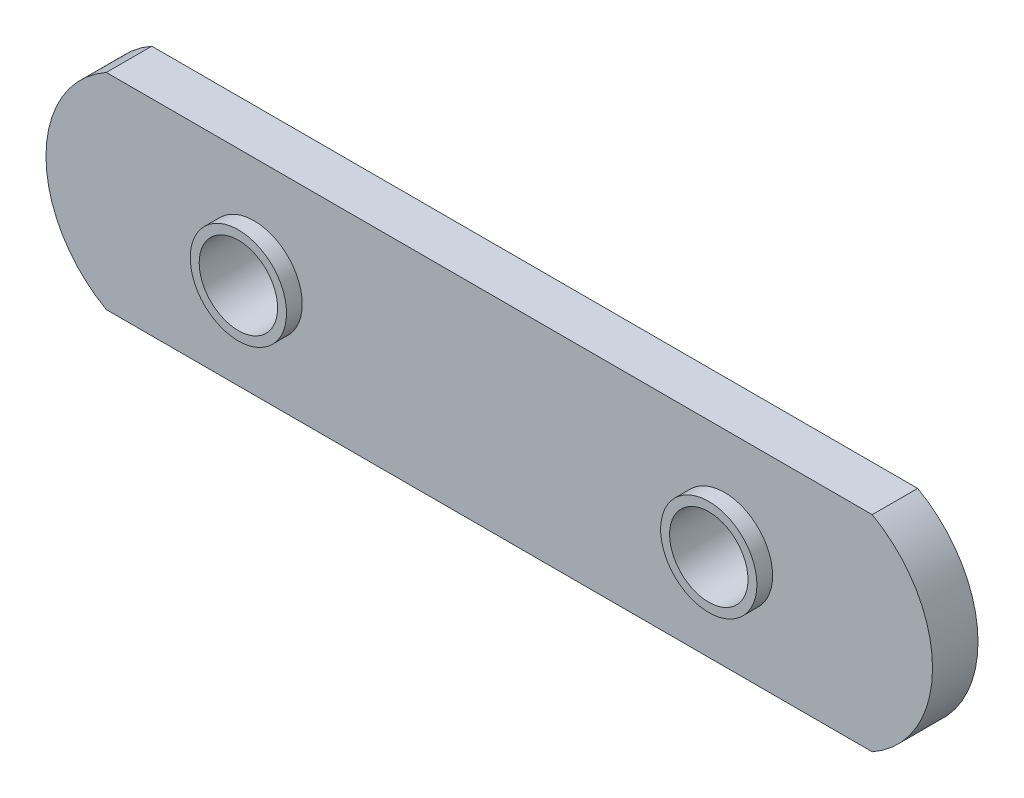
from build123d import *

# Parameters (mm, degrees)
BOSS_EXTRUDE1_DEPTH               = 1.8415
SKETCH2_R                         = 3.8989
BOSS_EXTRUDE2_DEPTH               = 1.27
F_1_4_20_TAPPED_HOLE1_D           = 5.1054
F_1_4_20_TAPPED_HOLE1_DEPTH       = 16.51
F_1_4_20_TAPPED_HOLE1_CBORE_D     = 6.35
F_1_4_20_TAPPED_HOLE1_CBORE_DEPTH = 12.7
F_1_4_20_TAPPED_HOLE1_TIP         = 1.533816902


with BuildPart() as part:
    # Sketch1 → Boss-Extrude1 (new, symmetric)
    with BuildSketch(Plane.XY):
        with BuildLine():
            Line((-31.017747277, 8.3185), (31.017747277, 8.3185))
            ThreePointArc((31.017747277, 8.3185), (35.9029, 0), (31.017747277, -8.3185))
            Line((31.017747277, -8.3185), (-31.017747277, -8.3185))
            ThreePointArc((-31.017747277, -8.3185), (-35.9029, 0), (-31.017747277, 8.3185))
        make_face()
    extrude(amount=BOSS_EXTRUDE1_DEPTH, both=True)

    # Sketch2 → Boss-Extrude2 (add)
    with BuildSketch(Plane.XY.offset(1.8415)):
        with Locations((19.05, 0)):
            Circle(SKETCH2_R)
        with Locations((-19.05, 0)):
            Circle(SKETCH2_R)
    extrude(amount=BOSS_EXTRUDE2_DEPTH)

    # 1/4-20 Tapped Hole1
    with Locations(Plane(origin=(0, 0, -1.8415), x_dir=(-1, 0, 0), z_dir=(0, 0, -1))):
        with Locations((19.05, 0), (-19.05, 0)):
            CounterBoreHole(F_1_4_20_TAPPED_HOLE1_D / 2, F_1_4_20_TAPPED_HOLE1_CBORE_D / 2, F_1_4_20_TAPPED_HOLE1_CBORE_DEPTH, depth=F_1_4_20_TAPPED_HOLE1_DEPTH)
            with Locations((0, 0, -(F_1_4_20_TAPPED_HOLE1_DEPTH + F_1_4_20_TAPPED_HOLE1_TIP / 2))):  # 118° drill point
                Cone(0, F_1_4_20_TAPPED_HOLE1_D / 2, F_1_4_20_TAPPED_HOLE1_TIP, mode=Mode.SUBTRACT)


solid = part.part
